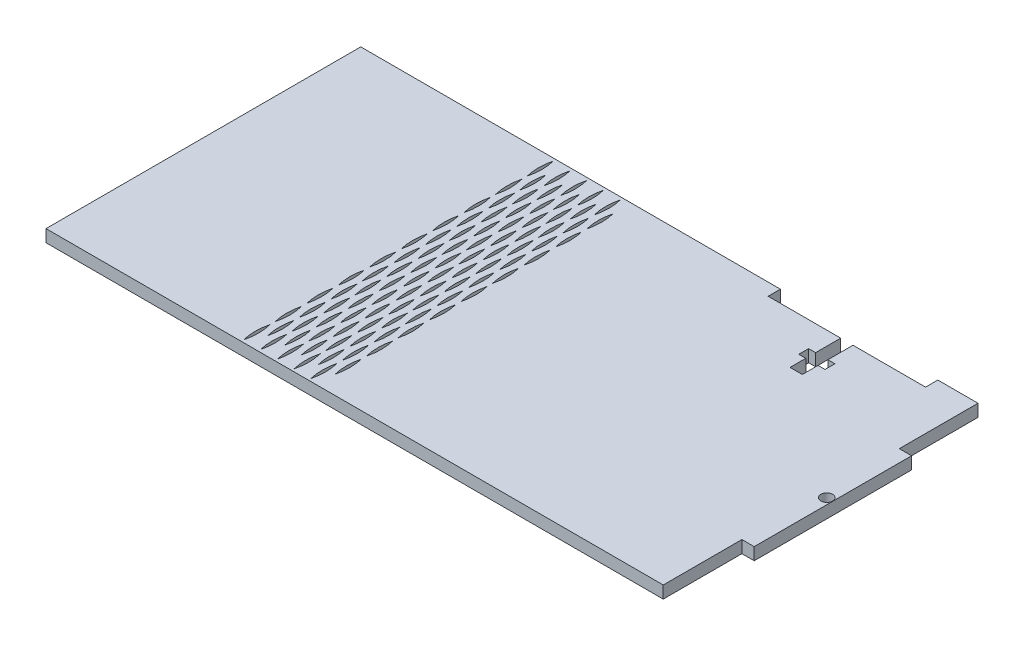
from build123d import *

# Parameters (mm, degrees)
SKETCH1_W               = 152.4
SKETCH1_H               = 76.2
BOSS_EXTRUDE1_DEPTH     = 2.9718
SKETCH2_W               = 2.9718
SKETCH2_H               = 19.05
CUT_EXTRUDE1_DEPTH      = 86.24600633
SKETCH4_R               = 1.4224
CUT_EXTRUDE3_DEPTH      = 86.24600633
CUT_EXTRUDE4_DEPTH      = 86.24600633
LPATTERN1_COUNT         = 10
LPATTERN1_PITCH         = 7.62
CUT_EXTRUDE6_DEPTH      = 86.24600633
LPATTERN2_COUNT         = 9
LPATTERN2_PITCH         = 7.62
LPATTERN3_COUNT         = 5
LPATTERN3_PITCH         = 4.064
LPATTERN3_COPY_1_DEPTH  = 86.24600633
LPATTERN3_COPY_2_DEPTH  = 86.24600633
LPATTERN3_COPY_3_DEPTH  = 86.24600633
LPATTERN3_COPY_4_DEPTH  = 86.24600633
LPATTERN3_COPY_5_DEPTH  = 86.24600633
LPATTERN3_COPY_6_DEPTH  = 86.24600633
LPATTERN3_COPY_7_DEPTH  = 86.24600633
LPATTERN3_COPY_8_DEPTH  = 86.24600633
LPATTERN3_COPY_9_DEPTH  = 86.24600633
LPATTERN3_COPY_10_DEPTH = 86.24600633
LPATTERN3_COPY_11_DEPTH = 86.24600633
LPATTERN3_COPY_12_DEPTH = 86.24600633
LPATTERN3_COPY_13_DEPTH = 86.24600633
LPATTERN3_COPY_14_DEPTH = 86.24600633
LPATTERN3_COPY_15_DEPTH = 86.24600633
LPATTERN3_COPY_16_DEPTH = 86.24600633
LPATTERN3_COPY_17_DEPTH = 86.24600633
LPATTERN3_COPY_18_DEPTH = 86.24600633
LPATTERN3_COPY_19_DEPTH = 86.24600633
LPATTERN3_COPY_20_DEPTH = 86.24600633
LPATTERN3_COPY_21_DEPTH = 86.24600633
LPATTERN3_COPY_22_DEPTH = 86.24600633
LPATTERN3_COPY_23_DEPTH = 86.24600633
LPATTERN3_COPY_24_DEPTH = 86.24600633
LPATTERN3_COPY_25_DEPTH = 86.24600633
LPATTERN3_COPY_26_DEPTH = 86.24600633
LPATTERN3_COPY_27_DEPTH = 86.24600633
LPATTERN3_COPY_28_DEPTH = 86.24600633
LPATTERN3_COPY_29_DEPTH = 86.24600633
LPATTERN3_COPY_30_DEPTH = 86.24600633
LPATTERN3_COPY_31_DEPTH = 86.24600633
LPATTERN3_COPY_32_DEPTH = 86.24600633
LPATTERN3_COPY_33_DEPTH = 86.24600633
LPATTERN3_COPY_34_DEPTH = 86.24600633
LPATTERN3_COPY_35_DEPTH = 86.24600633
LPATTERN3_COPY_36_DEPTH = 86.24600633
LPATTERN3_COPY_37_DEPTH = 86.24600633
LPATTERN3_COPY_38_DEPTH = 86.24600633
LPATTERN3_COPY_39_DEPTH = 86.24600633
LPATTERN3_COPY_40_DEPTH = 86.24600633
LPATTERN3_COPY_41_DEPTH = 86.24600633
LPATTERN3_COPY_42_DEPTH = 86.24600633
LPATTERN3_COPY_43_DEPTH = 86.24600633
LPATTERN3_COPY_44_DEPTH = 86.24600633
LPATTERN3_COPY_45_DEPTH = 86.24600633
LPATTERN3_COPY_46_DEPTH = 86.24600633
LPATTERN3_COPY_47_DEPTH = 86.24600633
LPATTERN3_COPY_48_DEPTH = 86.24600633
LPATTERN3_COPY_49_DEPTH = 86.24600633
LPATTERN3_COPY_50_DEPTH = 86.24600633
LPATTERN3_COPY_51_DEPTH = 86.24600633
LPATTERN3_COPY_52_DEPTH = 86.24600633
LPATTERN3_COPY_53_DEPTH = 86.24600633
LPATTERN3_COPY_54_DEPTH = 86.24600633
LPATTERN3_COPY_55_DEPTH = 86.24600633
LPATTERN3_COPY_56_DEPTH = 86.24600633
LPATTERN3_COPY_57_DEPTH = 86.24600633
LPATTERN3_COPY_58_DEPTH = 86.24600633
LPATTERN3_COPY_59_DEPTH = 86.24600633
LPATTERN3_COPY_60_DEPTH = 86.24600633
LPATTERN3_COPY_61_DEPTH = 86.24600633
LPATTERN3_COPY_62_DEPTH = 86.24600633
LPATTERN3_COPY_63_DEPTH = 86.24600633
LPATTERN3_COPY_64_DEPTH = 86.24600633
LPATTERN3_COPY_65_DEPTH = 86.24600633
LPATTERN3_COPY_66_DEPTH = 86.24600633
LPATTERN3_COPY_67_DEPTH = 86.24600633
LPATTERN3_COPY_68_DEPTH = 86.24600633
CUT_EXTRUDE7_DEPTH      = 86.24600633


with BuildPart() as part:
    # Sketch1 → Boss-Extrude1 (new body)
    with BuildSketch(Plane(origin=(0, 0, 0), x_dir=(1, 0, 0), z_dir=(0, 1, 0))):
        Rectangle(SKETCH1_W, SKETCH1_H)
    extrude(amount=BOSS_EXTRUDE1_DEPTH)

    # Sketch2 → Cut-Extrude1 (cut, through all)
    with BuildSketch(Plane(origin=(0, 2.9718, 0), x_dir=(1, 0, 0), z_dir=(0, 1, 0))):
        with Locations((74.7141, 28.575)):
            Rectangle(SKETCH2_W, SKETCH2_H)
    cut_extrude1 = extrude(amount=-CUT_EXTRUDE1_DEPTH, mode=Mode.SUBTRACT)

    # Mirror1: Cut-Extrude1 across plane
    add(cut_extrude1.mirror(Plane.XY), mode=Mode.SUBTRACT)

    # Sketch4 → Cut-Extrude3 (cut, through all)
    with BuildSketch(Plane(origin=(0, 2.9718, 0), x_dir=(1, 0, 0), z_dir=(0, 1, 0))):
        with Locations(Location((74.7141, 0, 0), (0, 0, 270))):
            Circle(SKETCH4_R)
    extrude(amount=-CUT_EXTRUDE3_DEPTH, mode=Mode.SUBTRACT)

    # Sketch5 → Cut-Extrude4 (cut, through all)
    with BuildSketch(Plane(origin=(0, 2.9718, 0), x_dir=(1, 0, 0), z_dir=(0, 1, 0))):
        with BuildLine():
            ThreePointArc((-12.7, 31.115), (-12.309139639, 34.29), (-12.7, 37.465))
            ThreePointArc((-12.7, 37.465), (-13.090860361, 34.29), (-12.7, 31.115))
        make_face()
    cut_extrude4 = extrude(amount=-CUT_EXTRUDE4_DEPTH, mode=Mode.SUBTRACT)

    # LPattern1: Cut-Extrude4 ×10
    with Locations(*[(0, 0, i * LPATTERN1_PITCH) for i in range(1, LPATTERN1_COUNT)]):
        add(cut_extrude4, mode=Mode.SUBTRACT)

    # Sketch5<3> → Cut-Extrude6 (cut, through all)
    with BuildSketch(Plane(origin=(0, 2.9718, 0), x_dir=(1, 0, 0), z_dir=(0, 1, 0))):
        with BuildLine():
            ThreePointArc((-12.7, 31.115), (-12.309139639, 34.29), (-12.7, 37.465))
            ThreePointArc((-12.7, 37.465), (-13.090860361, 34.29), (-12.7, 31.115))
        make_face()
        with BuildLine():
            ThreePointArc((-10.668, 27.305), (-10.277139639, 30.48), (-10.668, 33.655))
            ThreePointArc((-10.668, 33.655), (-11.058860361, 30.48), (-10.668, 27.305))
        make_face()
    cut_extrude6 = extrude(amount=-CUT_EXTRUDE6_DEPTH, mode=Mode.SUBTRACT)

    # LPattern2: Cut-Extrude6 ×9
    with Locations(*[(0, 0, i * LPATTERN2_PITCH) for i in range(1, LPATTERN2_COUNT)]):
        add(cut_extrude6, mode=Mode.SUBTRACT)

    # LPattern3: Cut-Extrude4, Cut-Extrude6 ×5
    with Locations(*[(-i * LPATTERN3_PITCH, 0, 0) for i in range(1, LPATTERN3_COUNT)]):
        add(cut_extrude4, mode=Mode.SUBTRACT)
        add(cut_extrude6, mode=Mode.SUBTRACT)

    # LPattern3 copy 1 sketch → LPattern3 copy 1 (cut, through all)
    with BuildSketch(Plane(origin=(-4.064, 2.9718, 7.62), x_dir=(1, 0, 0), z_dir=(0, 1, 0))):
        with BuildLine():
            ThreePointArc((-12.7, 31.115), (-12.309139639, 34.29), (-12.7, 37.465))
            ThreePointArc((-12.7, 37.465), (-13.090860361, 34.29), (-12.7, 31.115))
        make_face()
    extrude(amount=-LPATTERN3_COPY_1_DEPTH, mode=Mode.SUBTRACT)

    # LPattern3 copy 2 sketch → LPattern3 copy 2 (cut, through all)
    with BuildSketch(Plane(origin=(-8.128, 2.9718, 7.62), x_dir=(1, 0, 0), z_dir=(0, 1, 0))):
        with BuildLine():
            ThreePointArc((-12.7, 31.115), (-12.309139639, 34.29), (-12.7, 37.465))
            ThreePointArc((-12.7, 37.465), (-13.090860361, 34.29), (-12.7, 31.115))
        make_face()
    extrude(amount=-LPATTERN3_COPY_2_DEPTH, mode=Mode.SUBTRACT)

    # LPattern3 copy 3 sketch → LPattern3 copy 3 (cut, through all)
    with BuildSketch(Plane(origin=(-12.192, 2.9718, 7.62), x_dir=(1, 0, 0), z_dir=(0, 1, 0))):
        with BuildLine():
            ThreePointArc((-12.7, 31.115), (-12.309139639, 34.29), (-12.7, 37.465))
            ThreePointArc((-12.7, 37.465), (-13.090860361, 34.29), (-12.7, 31.115))
        make_face()
    extrude(amount=-LPATTERN3_COPY_3_DEPTH, mode=Mode.SUBTRACT)

    # LPattern3 copy 4 sketch → LPattern3 copy 4 (cut, through all)
    with BuildSketch(Plane(origin=(-16.256, 2.9718, 7.62), x_dir=(1, 0, 0), z_dir=(0, 1, 0))):
        with BuildLine():
            ThreePointArc((-12.7, 31.115), (-12.309139639, 34.29), (-12.7, 37.465))
            ThreePointArc((-12.7, 37.465), (-13.090860361, 34.29), (-12.7, 31.115))
        make_face()
    extrude(amount=-LPATTERN3_COPY_4_DEPTH, mode=Mode.SUBTRACT)

    # LPattern3 copy 5 sketch → LPattern3 copy 5 (cut, through all)
    with BuildSketch(Plane(origin=(-4.064, 2.9718, 15.24), x_dir=(1, 0, 0), z_dir=(0, 1, 0))):
        with BuildLine():
            ThreePointArc((-12.7, 31.115), (-12.309139639, 34.29), (-12.7, 37.465))
            ThreePointArc((-12.7, 37.465), (-13.090860361, 34.29), (-12.7, 31.115))
        make_face()
    extrude(amount=-LPATTERN3_COPY_5_DEPTH, mode=Mode.SUBTRACT)

    # LPattern3 copy 6 sketch → LPattern3 copy 6 (cut, through all)
    with BuildSketch(Plane(origin=(-8.128, 2.9718, 15.24), x_dir=(1, 0, 0), z_dir=(0, 1, 0))):
        with BuildLine():
            ThreePointArc((-12.7, 31.115), (-12.309139639, 34.29), (-12.7, 37.465))
            ThreePointArc((-12.7, 37.465), (-13.090860361, 34.29), (-12.7, 31.115))
        make_face()
    extrude(amount=-LPATTERN3_COPY_6_DEPTH, mode=Mode.SUBTRACT)

    # LPattern3 copy 7 sketch → LPattern3 copy 7 (cut, through all)
    with BuildSketch(Plane(origin=(-12.192, 2.9718, 15.24), x_dir=(1, 0, 0), z_dir=(0, 1, 0))):
        with BuildLine():
            ThreePointArc((-12.7, 31.115), (-12.309139639, 34.29), (-12.7, 37.465))
            ThreePointArc((-12.7, 37.465), (-13.090860361, 34.29), (-12.7, 31.115))
        make_face()
    extrude(amount=-LPATTERN3_COPY_7_DEPTH, mode=Mode.SUBTRACT)

    # LPattern3 copy 8 sketch → LPattern3 copy 8 (cut, through all)
    with BuildSketch(Plane(origin=(-16.256, 2.9718, 15.24), x_dir=(1, 0, 0), z_dir=(0, 1, 0))):
        with BuildLine():
            ThreePointArc((-12.7, 31.115), (-12.309139639, 34.29), (-12.7, 37.465))
            ThreePointArc((-12.7, 37.465), (-13.090860361, 34.29), (-12.7, 31.115))
        make_face()
    extrude(amount=-LPATTERN3_COPY_8_DEPTH, mode=Mode.SUBTRACT)

    # LPattern3 copy 9 sketch → LPattern3 copy 9 (cut, through all)
    with BuildSketch(Plane(origin=(-4.064, 2.9718, 22.86), x_dir=(1, 0, 0), z_dir=(0, 1, 0))):
        with BuildLine():
            ThreePointArc((-12.7, 31.115), (-12.309139639, 34.29), (-12.7, 37.465))
            ThreePointArc((-12.7, 37.465), (-13.090860361, 34.29), (-12.7, 31.115))
        make_face()
    extrude(amount=-LPATTERN3_COPY_9_DEPTH, mode=Mode.SUBTRACT)

    # LPattern3 copy 10 sketch → LPattern3 copy 10 (cut, through all)
    with BuildSketch(Plane(origin=(-8.128, 2.9718, 22.86), x_dir=(1, 0, 0), z_dir=(0, 1, 0))):
        with BuildLine():
            ThreePointArc((-12.7, 31.115), (-12.309139639, 34.29), (-12.7, 37.465))
            ThreePointArc((-12.7, 37.465), (-13.090860361, 34.29), (-12.7, 31.115))
        make_face()
    extrude(amount=-LPATTERN3_COPY_10_DEPTH, mode=Mode.SUBTRACT)

    # LPattern3 copy 11 sketch → LPattern3 copy 11 (cut, through all)
    with BuildSketch(Plane(origin=(-12.192, 2.9718, 22.86), x_dir=(1, 0, 0), z_dir=(0, 1, 0))):
        with BuildLine():
            ThreePointArc((-12.7, 31.115), (-12.309139639, 34.29), (-12.7, 37.465))
            ThreePointArc((-12.7, 37.465), (-13.090860361, 34.29), (-12.7, 31.115))
        make_face()
    extrude(amount=-LPATTERN3_COPY_11_DEPTH, mode=Mode.SUBTRACT)

    # LPattern3 copy 12 sketch → LPattern3 copy 12 (cut, through all)
    with BuildSketch(Plane(origin=(-16.256, 2.9718, 22.86), x_dir=(1, 0, 0), z_dir=(0, 1, 0))):
        with BuildLine():
            ThreePointArc((-12.7, 31.115), (-12.309139639, 34.29), (-12.7, 37.465))
            ThreePointArc((-12.7, 37.465), (-13.090860361, 34.29), (-12.7, 31.115))
        make_face()
    extrude(amount=-LPATTERN3_COPY_12_DEPTH, mode=Mode.SUBTRACT)

    # LPattern3 copy 13 sketch → LPattern3 copy 13 (cut, through all)
    with BuildSketch(Plane(origin=(-4.064, 2.9718, 30.48), x_dir=(1, 0, 0), z_dir=(0, 1, 0))):
        with BuildLine():
            ThreePointArc((-12.7, 31.115), (-12.309139639, 34.29), (-12.7, 37.465))
            ThreePointArc((-12.7, 37.465), (-13.090860361, 34.29), (-12.7, 31.115))
        make_face()
    extrude(amount=-LPATTERN3_COPY_13_DEPTH, mode=Mode.SUBTRACT)

    # LPattern3 copy 14 sketch → LPattern3 copy 14 (cut, through all)
    with BuildSketch(Plane(origin=(-8.128, 2.9718, 30.48), x_dir=(1, 0, 0), z_dir=(0, 1, 0))):
        with BuildLine():
            ThreePointArc((-12.7, 31.115), (-12.309139639, 34.29), (-12.7, 37.465))
            ThreePointArc((-12.7, 37.465), (-13.090860361, 34.29), (-12.7, 31.115))
        make_face()
    extrude(amount=-LPATTERN3_COPY_14_DEPTH, mode=Mode.SUBTRACT)

    # LPattern3 copy 15 sketch → LPattern3 copy 15 (cut, through all)
    with BuildSketch(Plane(origin=(-12.192, 2.9718, 30.48), x_dir=(1, 0, 0), z_dir=(0, 1, 0))):
        with BuildLine():
            ThreePointArc((-12.7, 31.115), (-12.309139639, 34.29), (-12.7, 37.465))
            ThreePointArc((-12.7, 37.465), (-13.090860361, 34.29), (-12.7, 31.115))
        make_face()
    extrude(amount=-LPATTERN3_COPY_15_DEPTH, mode=Mode.SUBTRACT)

    # LPattern3 copy 16 sketch → LPattern3 copy 16 (cut, through all)
    with BuildSketch(Plane(origin=(-16.256, 2.9718, 30.48), x_dir=(1, 0, 0), z_dir=(0, 1, 0))):
        with BuildLine():
            ThreePointArc((-12.7, 31.115), (-12.309139639, 34.29), (-12.7, 37.465))
            ThreePointArc((-12.7, 37.465), (-13.090860361, 34.29), (-12.7, 31.115))
        make_face()
    extrude(amount=-LPATTERN3_COPY_16_DEPTH, mode=Mode.SUBTRACT)

    # LPattern3 copy 17 sketch → LPattern3 copy 17 (cut, through all)
    with BuildSketch(Plane(origin=(-4.064, 2.9718, 38.1), x_dir=(1, 0, 0), z_dir=(0, 1, 0))):
        with BuildLine():
            ThreePointArc((-12.7, 31.115), (-12.309139639, 34.29), (-12.7, 37.465))
            ThreePointArc((-12.7, 37.465), (-13.090860361, 34.29), (-12.7, 31.115))
        make_face()
    extrude(amount=-LPATTERN3_COPY_17_DEPTH, mode=Mode.SUBTRACT)

    # LPattern3 copy 18 sketch → LPattern3 copy 18 (cut, through all)
    with BuildSketch(Plane(origin=(-8.128, 2.9718, 38.1), x_dir=(1, 0, 0), z_dir=(0, 1, 0))):
        with BuildLine():
            ThreePointArc((-12.7, 31.115), (-12.309139639, 34.29), (-12.7, 37.465))
            ThreePointArc((-12.7, 37.465), (-13.090860361, 34.29), (-12.7, 31.115))
        make_face()
    extrude(amount=-LPATTERN3_COPY_18_DEPTH, mode=Mode.SUBTRACT)

    # LPattern3 copy 19 sketch → LPattern3 copy 19 (cut, through all)
    with BuildSketch(Plane(origin=(-12.192, 2.9718, 38.1), x_dir=(1, 0, 0), z_dir=(0, 1, 0))):
        with BuildLine():
            ThreePointArc((-12.7, 31.115), (-12.309139639, 34.29), (-12.7, 37.465))
            ThreePointArc((-12.7, 37.465), (-13.090860361, 34.29), (-12.7, 31.115))
        make_face()
    extrude(amount=-LPATTERN3_COPY_19_DEPTH, mode=Mode.SUBTRACT)

    # LPattern3 copy 20 sketch → LPattern3 copy 20 (cut, through all)
    with BuildSketch(Plane(origin=(-16.256, 2.9718, 38.1), x_dir=(1, 0, 0), z_dir=(0, 1, 0))):
        with BuildLine():
            ThreePointArc((-12.7, 31.115), (-12.309139639, 34.29), (-12.7, 37.465))
            ThreePointArc((-12.7, 37.465), (-13.090860361, 34.29), (-12.7, 31.115))
        make_face()
    extrude(amount=-LPATTERN3_COPY_20_DEPTH, mode=Mode.SUBTRACT)

    # LPattern3 copy 21 sketch → LPattern3 copy 21 (cut, through all)
    with BuildSketch(Plane(origin=(-4.064, 2.9718, 45.72), x_dir=(1, 0, 0), z_dir=(0, 1, 0))):
        with BuildLine():
            ThreePointArc((-12.7, 31.115), (-12.309139639, 34.29), (-12.7, 37.465))
            ThreePointArc((-12.7, 37.465), (-13.090860361, 34.29), (-12.7, 31.115))
        make_face()
    extrude(amount=-LPATTERN3_COPY_21_DEPTH, mode=Mode.SUBTRACT)

    # LPattern3 copy 22 sketch → LPattern3 copy 22 (cut, through all)
    with BuildSketch(Plane(origin=(-8.128, 2.9718, 45.72), x_dir=(1, 0, 0), z_dir=(0, 1, 0))):
        with BuildLine():
            ThreePointArc((-12.7, 31.115), (-12.309139639, 34.29), (-12.7, 37.465))
            ThreePointArc((-12.7, 37.465), (-13.090860361, 34.29), (-12.7, 31.115))
        make_face()
    extrude(amount=-LPATTERN3_COPY_22_DEPTH, mode=Mode.SUBTRACT)

    # LPattern3 copy 23 sketch → LPattern3 copy 23 (cut, through all)
    with BuildSketch(Plane(origin=(-12.192, 2.9718, 45.72), x_dir=(1, 0, 0), z_dir=(0, 1, 0))):
        with BuildLine():
            ThreePointArc((-12.7, 31.115), (-12.309139639, 34.29), (-12.7, 37.465))
            ThreePointArc((-12.7, 37.465), (-13.090860361, 34.29), (-12.7, 31.115))
        make_face()
    extrude(amount=-LPATTERN3_COPY_23_DEPTH, mode=Mode.SUBTRACT)

    # LPattern3 copy 24 sketch → LPattern3 copy 24 (cut, through all)
    with BuildSketch(Plane(origin=(-16.256, 2.9718, 45.72), x_dir=(1, 0, 0), z_dir=(0, 1, 0))):
        with BuildLine():
            ThreePointArc((-12.7, 31.115), (-12.309139639, 34.29), (-12.7, 37.465))
            ThreePointArc((-12.7, 37.465), (-13.090860361, 34.29), (-12.7, 31.115))
        make_face()
    extrude(amount=-LPATTERN3_COPY_24_DEPTH, mode=Mode.SUBTRACT)

    # LPattern3 copy 25 sketch → LPattern3 copy 25 (cut, through all)
    with BuildSketch(Plane(origin=(-4.064, 2.9718, 53.34), x_dir=(1, 0, 0), z_dir=(0, 1, 0))):
        with BuildLine():
            ThreePointArc((-12.7, 31.115), (-12.309139639, 34.29), (-12.7, 37.465))
            ThreePointArc((-12.7, 37.465), (-13.090860361, 34.29), (-12.7, 31.115))
        make_face()
    extrude(amount=-LPATTERN3_COPY_25_DEPTH, mode=Mode.SUBTRACT)

    # LPattern3 copy 26 sketch → LPattern3 copy 26 (cut, through all)
    with BuildSketch(Plane(origin=(-8.128, 2.9718, 53.34), x_dir=(1, 0, 0), z_dir=(0, 1, 0))):
        with BuildLine():
            ThreePointArc((-12.7, 31.115), (-12.309139639, 34.29), (-12.7, 37.465))
            ThreePointArc((-12.7, 37.465), (-13.090860361, 34.29), (-12.7, 31.115))
        make_face()
    extrude(amount=-LPATTERN3_COPY_26_DEPTH, mode=Mode.SUBTRACT)

    # LPattern3 copy 27 sketch → LPattern3 copy 27 (cut, through all)
    with BuildSketch(Plane(origin=(-12.192, 2.9718, 53.34), x_dir=(1, 0, 0), z_dir=(0, 1, 0))):
        with BuildLine():
            ThreePointArc((-12.7, 31.115), (-12.309139639, 34.29), (-12.7, 37.465))
            ThreePointArc((-12.7, 37.465), (-13.090860361, 34.29), (-12.7, 31.115))
        make_face()
    extrude(amount=-LPATTERN3_COPY_27_DEPTH, mode=Mode.SUBTRACT)

    # LPattern3 copy 28 sketch → LPattern3 copy 28 (cut, through all)
    with BuildSketch(Plane(origin=(-16.256, 2.9718, 53.34), x_dir=(1, 0, 0), z_dir=(0, 1, 0))):
        with BuildLine():
            ThreePointArc((-12.7, 31.115), (-12.309139639, 34.29), (-12.7, 37.465))
            ThreePointArc((-12.7, 37.465), (-13.090860361, 34.29), (-12.7, 31.115))
        make_face()
    extrude(amount=-LPATTERN3_COPY_28_DEPTH, mode=Mode.SUBTRACT)

    # LPattern3 copy 29 sketch → LPattern3 copy 29 (cut, through all)
    with BuildSketch(Plane(origin=(-4.064, 2.9718, 60.96), x_dir=(1, 0, 0), z_dir=(0, 1, 0))):
        with BuildLine():
            ThreePointArc((-12.7, 31.115), (-12.309139639, 34.29), (-12.7, 37.465))
            ThreePointArc((-12.7, 37.465), (-13.090860361, 34.29), (-12.7, 31.115))
        make_face()
    extrude(amount=-LPATTERN3_COPY_29_DEPTH, mode=Mode.SUBTRACT)

    # LPattern3 copy 30 sketch → LPattern3 copy 30 (cut, through all)
    with BuildSketch(Plane(origin=(-8.128, 2.9718, 60.96), x_dir=(1, 0, 0), z_dir=(0, 1, 0))):
        with BuildLine():
            ThreePointArc((-12.7, 31.115), (-12.309139639, 34.29), (-12.7, 37.465))
            ThreePointArc((-12.7, 37.465), (-13.090860361, 34.29), (-12.7, 31.115))
        make_face()
    extrude(amount=-LPATTERN3_COPY_30_DEPTH, mode=Mode.SUBTRACT)

    # LPattern3 copy 31 sketch → LPattern3 copy 31 (cut, through all)
    with BuildSketch(Plane(origin=(-12.192, 2.9718, 60.96), x_dir=(1, 0, 0), z_dir=(0, 1, 0))):
        with BuildLine():
            ThreePointArc((-12.7, 31.115), (-12.309139639, 34.29), (-12.7, 37.465))
            ThreePointArc((-12.7, 37.465), (-13.090860361, 34.29), (-12.7, 31.115))
        make_face()
    extrude(amount=-LPATTERN3_COPY_31_DEPTH, mode=Mode.SUBTRACT)

    # LPattern3 copy 32 sketch → LPattern3 copy 32 (cut, through all)
    with BuildSketch(Plane(origin=(-16.256, 2.9718, 60.96), x_dir=(1, 0, 0), z_dir=(0, 1, 0))):
        with BuildLine():
            ThreePointArc((-12.7, 31.115), (-12.309139639, 34.29), (-12.7, 37.465))
            ThreePointArc((-12.7, 37.465), (-13.090860361, 34.29), (-12.7, 31.115))
        make_face()
    extrude(amount=-LPATTERN3_COPY_32_DEPTH, mode=Mode.SUBTRACT)

    # LPattern3 copy 33 sketch → LPattern3 copy 33 (cut, through all)
    with BuildSketch(Plane(origin=(-4.064, 2.9718, 68.58), x_dir=(1, 0, 0), z_dir=(0, 1, 0))):
        with BuildLine():
            ThreePointArc((-12.7, 31.115), (-12.309139639, 34.29), (-12.7, 37.465))
            ThreePointArc((-12.7, 37.465), (-13.090860361, 34.29), (-12.7, 31.115))
        make_face()
    extrude(amount=-LPATTERN3_COPY_33_DEPTH, mode=Mode.SUBTRACT)

    # LPattern3 copy 34 sketch → LPattern3 copy 34 (cut, through all)
    with BuildSketch(Plane(origin=(-8.128, 2.9718, 68.58), x_dir=(1, 0, 0), z_dir=(0, 1, 0))):
        with BuildLine():
            ThreePointArc((-12.7, 31.115), (-12.309139639, 34.29), (-12.7, 37.465))
            ThreePointArc((-12.7, 37.465), (-13.090860361, 34.29), (-12.7, 31.115))
        make_face()
    extrude(amount=-LPATTERN3_COPY_34_DEPTH, mode=Mode.SUBTRACT)

    # LPattern3 copy 35 sketch → LPattern3 copy 35 (cut, through all)
    with BuildSketch(Plane(origin=(-12.192, 2.9718, 68.58), x_dir=(1, 0, 0), z_dir=(0, 1, 0))):
        with BuildLine():
            ThreePointArc((-12.7, 31.115), (-12.309139639, 34.29), (-12.7, 37.465))
            ThreePointArc((-12.7, 37.465), (-13.090860361, 34.29), (-12.7, 31.115))
        make_face()
    extrude(amount=-LPATTERN3_COPY_35_DEPTH, mode=Mode.SUBTRACT)

    # LPattern3 copy 36 sketch → LPattern3 copy 36 (cut, through all)
    with BuildSketch(Plane(origin=(-16.256, 2.9718, 68.58), x_dir=(1, 0, 0), z_dir=(0, 1, 0))):
        with BuildLine():
            ThreePointArc((-12.7, 31.115), (-12.309139639, 34.29), (-12.7, 37.465))
            ThreePointArc((-12.7, 37.465), (-13.090860361, 34.29), (-12.7, 31.115))
        make_face()
    extrude(amount=-LPATTERN3_COPY_36_DEPTH, mode=Mode.SUBTRACT)

    # LPattern3 copy 37 sketch → LPattern3 copy 37 (cut, through all)
    with BuildSketch(Plane(origin=(-4.064, 2.9718, 7.62), x_dir=(1, 0, 0), z_dir=(0, 1, 0))):
        with BuildLine():
            ThreePointArc((-12.7, 31.115), (-12.309139639, 34.29), (-12.7, 37.465))
            ThreePointArc((-12.7, 37.465), (-13.090860361, 34.29), (-12.7, 31.115))
        make_face()
        with BuildLine():
            ThreePointArc((-10.668, 27.305), (-10.277139639, 30.48), (-10.668, 33.655))
            ThreePointArc((-10.668, 33.655), (-11.058860361, 30.48), (-10.668, 27.305))
        make_face()
    extrude(amount=-LPATTERN3_COPY_37_DEPTH, mode=Mode.SUBTRACT)

    # LPattern3 copy 38 sketch → LPattern3 copy 38 (cut, through all)
    with BuildSketch(Plane(origin=(-8.128, 2.9718, 7.62), x_dir=(1, 0, 0), z_dir=(0, 1, 0))):
        with BuildLine():
            ThreePointArc((-12.7, 31.115), (-12.309139639, 34.29), (-12.7, 37.465))
            ThreePointArc((-12.7, 37.465), (-13.090860361, 34.29), (-12.7, 31.115))
        make_face()
        with BuildLine():
            ThreePointArc((-10.668, 27.305), (-10.277139639, 30.48), (-10.668, 33.655))
            ThreePointArc((-10.668, 33.655), (-11.058860361, 30.48), (-10.668, 27.305))
        make_face()
    extrude(amount=-LPATTERN3_COPY_38_DEPTH, mode=Mode.SUBTRACT)

    # LPattern3 copy 39 sketch → LPattern3 copy 39 (cut, through all)
    with BuildSketch(Plane(origin=(-12.192, 2.9718, 7.62), x_dir=(1, 0, 0), z_dir=(0, 1, 0))):
        with BuildLine():
            ThreePointArc((-12.7, 31.115), (-12.309139639, 34.29), (-12.7, 37.465))
            ThreePointArc((-12.7, 37.465), (-13.090860361, 34.29), (-12.7, 31.115))
        make_face()
        with BuildLine():
            ThreePointArc((-10.668, 27.305), (-10.277139639, 30.48), (-10.668, 33.655))
            ThreePointArc((-10.668, 33.655), (-11.058860361, 30.48), (-10.668, 27.305))
        make_face()
    extrude(amount=-LPATTERN3_COPY_39_DEPTH, mode=Mode.SUBTRACT)

    # LPattern3 copy 40 sketch → LPattern3 copy 40 (cut, through all)
    with BuildSketch(Plane(origin=(-16.256, 2.9718, 7.62), x_dir=(1, 0, 0), z_dir=(0, 1, 0))):
        with BuildLine():
            ThreePointArc((-12.7, 31.115), (-12.309139639, 34.29), (-12.7, 37.465))
            ThreePointArc((-12.7, 37.465), (-13.090860361, 34.29), (-12.7, 31.115))
        make_face()
        with BuildLine():
            ThreePointArc((-10.668, 27.305), (-10.277139639, 30.48), (-10.668, 33.655))
            ThreePointArc((-10.668, 33.655), (-11.058860361, 30.48), (-10.668, 27.305))
        make_face()
    extrude(amount=-LPATTERN3_COPY_40_DEPTH, mode=Mode.SUBTRACT)

    # LPattern3 copy 41 sketch → LPattern3 copy 41 (cut, through all)
    with BuildSketch(Plane(origin=(-4.064, 2.9718, 15.24), x_dir=(1, 0, 0), z_dir=(0, 1, 0))):
        with BuildLine():
            ThreePointArc((-12.7, 31.115), (-12.309139639, 34.29), (-12.7, 37.465))
            ThreePointArc((-12.7, 37.465), (-13.090860361, 34.29), (-12.7, 31.115))
        make_face()
        with BuildLine():
            ThreePointArc((-10.668, 27.305), (-10.277139639, 30.48), (-10.668, 33.655))
            ThreePointArc((-10.668, 33.655), (-11.058860361, 30.48), (-10.668, 27.305))
        make_face()
    extrude(amount=-LPATTERN3_COPY_41_DEPTH, mode=Mode.SUBTRACT)

    # LPattern3 copy 42 sketch → LPattern3 copy 42 (cut, through all)
    with BuildSketch(Plane(origin=(-8.128, 2.9718, 15.24), x_dir=(1, 0, 0), z_dir=(0, 1, 0))):
        with BuildLine():
            ThreePointArc((-12.7, 31.115), (-12.309139639, 34.29), (-12.7, 37.465))
            ThreePointArc((-12.7, 37.465), (-13.090860361, 34.29), (-12.7, 31.115))
        make_face()
        with BuildLine():
            ThreePointArc((-10.668, 27.305), (-10.277139639, 30.48), (-10.668, 33.655))
            ThreePointArc((-10.668, 33.655), (-11.058860361, 30.48), (-10.668, 27.305))
        make_face()
    extrude(amount=-LPATTERN3_COPY_42_DEPTH, mode=Mode.SUBTRACT)

    # LPattern3 copy 43 sketch → LPattern3 copy 43 (cut, through all)
    with BuildSketch(Plane(origin=(-12.192, 2.9718, 15.24), x_dir=(1, 0, 0), z_dir=(0, 1, 0))):
        with BuildLine():
            ThreePointArc((-12.7, 31.115), (-12.309139639, 34.29), (-12.7, 37.465))
            ThreePointArc((-12.7, 37.465), (-13.090860361, 34.29), (-12.7, 31.115))
        make_face()
        with BuildLine():
            ThreePointArc((-10.668, 27.305), (-10.277139639, 30.48), (-10.668, 33.655))
            ThreePointArc((-10.668, 33.655), (-11.058860361, 30.48), (-10.668, 27.305))
        make_face()
    extrude(amount=-LPATTERN3_COPY_43_DEPTH, mode=Mode.SUBTRACT)

    # LPattern3 copy 44 sketch → LPattern3 copy 44 (cut, through all)
    with BuildSketch(Plane(origin=(-16.256, 2.9718, 15.24), x_dir=(1, 0, 0), z_dir=(0, 1, 0))):
        with BuildLine():
            ThreePointArc((-12.7, 31.115), (-12.309139639, 34.29), (-12.7, 37.465))
            ThreePointArc((-12.7, 37.465), (-13.090860361, 34.29), (-12.7, 31.115))
        make_face()
        with BuildLine():
            ThreePointArc((-10.668, 27.305), (-10.277139639, 30.48), (-10.668, 33.655))
            ThreePointArc((-10.668, 33.655), (-11.058860361, 30.48), (-10.668, 27.305))
        make_face()
    extrude(amount=-LPATTERN3_COPY_44_DEPTH, mode=Mode.SUBTRACT)

    # LPattern3 copy 45 sketch → LPattern3 copy 45 (cut, through all)
    with BuildSketch(Plane(origin=(-4.064, 2.9718, 22.86), x_dir=(1, 0, 0), z_dir=(0, 1, 0))):
        with BuildLine():
            ThreePointArc((-12.7, 31.115), (-12.309139639, 34.29), (-12.7, 37.465))
            ThreePointArc((-12.7, 37.465), (-13.090860361, 34.29), (-12.7, 31.115))
        make_face()
        with BuildLine():
            ThreePointArc((-10.668, 27.305), (-10.277139639, 30.48), (-10.668, 33.655))
            ThreePointArc((-10.668, 33.655), (-11.058860361, 30.48), (-10.668, 27.305))
        make_face()
    extrude(amount=-LPATTERN3_COPY_45_DEPTH, mode=Mode.SUBTRACT)

    # LPattern3 copy 46 sketch → LPattern3 copy 46 (cut, through all)
    with BuildSketch(Plane(origin=(-8.128, 2.9718, 22.86), x_dir=(1, 0, 0), z_dir=(0, 1, 0))):
        with BuildLine():
            ThreePointArc((-12.7, 31.115), (-12.309139639, 34.29), (-12.7, 37.465))
            ThreePointArc((-12.7, 37.465), (-13.090860361, 34.29), (-12.7, 31.115))
        make_face()
        with BuildLine():
            ThreePointArc((-10.668, 27.305), (-10.277139639, 30.48), (-10.668, 33.655))
            ThreePointArc((-10.668, 33.655), (-11.058860361, 30.48), (-10.668, 27.305))
        make_face()
    extrude(amount=-LPATTERN3_COPY_46_DEPTH, mode=Mode.SUBTRACT)

    # LPattern3 copy 47 sketch → LPattern3 copy 47 (cut, through all)
    with BuildSketch(Plane(origin=(-12.192, 2.9718, 22.86), x_dir=(1, 0, 0), z_dir=(0, 1, 0))):
        with BuildLine():
            ThreePointArc((-12.7, 31.115), (-12.309139639, 34.29), (-12.7, 37.465))
            ThreePointArc((-12.7, 37.465), (-13.090860361, 34.29), (-12.7, 31.115))
        make_face()
        with BuildLine():
            ThreePointArc((-10.668, 27.305), (-10.277139639, 30.48), (-10.668, 33.655))
            ThreePointArc((-10.668, 33.655), (-11.058860361, 30.48), (-10.668, 27.305))
        make_face()
    extrude(amount=-LPATTERN3_COPY_47_DEPTH, mode=Mode.SUBTRACT)

    # LPattern3 copy 48 sketch → LPattern3 copy 48 (cut, through all)
    with BuildSketch(Plane(origin=(-16.256, 2.9718, 22.86), x_dir=(1, 0, 0), z_dir=(0, 1, 0))):
        with BuildLine():
            ThreePointArc((-12.7, 31.115), (-12.309139639, 34.29), (-12.7, 37.465))
            ThreePointArc((-12.7, 37.465), (-13.090860361, 34.29), (-12.7, 31.115))
        make_face()
        with BuildLine():
            ThreePointArc((-10.668, 27.305), (-10.277139639, 30.48), (-10.668, 33.655))
            ThreePointArc((-10.668, 33.655), (-11.058860361, 30.48), (-10.668, 27.305))
        make_face()
    extrude(amount=-LPATTERN3_COPY_48_DEPTH, mode=Mode.SUBTRACT)

    # LPattern3 copy 49 sketch → LPattern3 copy 49 (cut, through all)
    with BuildSketch(Plane(origin=(-4.064, 2.9718, 30.48), x_dir=(1, 0, 0), z_dir=(0, 1, 0))):
        with BuildLine():
            ThreePointArc((-12.7, 31.115), (-12.309139639, 34.29), (-12.7, 37.465))
            ThreePointArc((-12.7, 37.465), (-13.090860361, 34.29), (-12.7, 31.115))
        make_face()
        with BuildLine():
            ThreePointArc((-10.668, 27.305), (-10.277139639, 30.48), (-10.668, 33.655))
            ThreePointArc((-10.668, 33.655), (-11.058860361, 30.48), (-10.668, 27.305))
        make_face()
    extrude(amount=-LPATTERN3_COPY_49_DEPTH, mode=Mode.SUBTRACT)

    # LPattern3 copy 50 sketch → LPattern3 copy 50 (cut, through all)
    with BuildSketch(Plane(origin=(-8.128, 2.9718, 30.48), x_dir=(1, 0, 0), z_dir=(0, 1, 0))):
        with BuildLine():
            ThreePointArc((-12.7, 31.115), (-12.309139639, 34.29), (-12.7, 37.465))
            ThreePointArc((-12.7, 37.465), (-13.090860361, 34.29), (-12.7, 31.115))
        make_face()
        with BuildLine():
            ThreePointArc((-10.668, 27.305), (-10.277139639, 30.48), (-10.668, 33.655))
            ThreePointArc((-10.668, 33.655), (-11.058860361, 30.48), (-10.668, 27.305))
        make_face()
    extrude(amount=-LPATTERN3_COPY_50_DEPTH, mode=Mode.SUBTRACT)

    # LPattern3 copy 51 sketch → LPattern3 copy 51 (cut, through all)
    with BuildSketch(Plane(origin=(-12.192, 2.9718, 30.48), x_dir=(1, 0, 0), z_dir=(0, 1, 0))):
        with BuildLine():
            ThreePointArc((-12.7, 31.115), (-12.309139639, 34.29), (-12.7, 37.465))
            ThreePointArc((-12.7, 37.465), (-13.090860361, 34.29), (-12.7, 31.115))
        make_face()
        with BuildLine():
            ThreePointArc((-10.668, 27.305), (-10.277139639, 30.48), (-10.668, 33.655))
            ThreePointArc((-10.668, 33.655), (-11.058860361, 30.48), (-10.668, 27.305))
        make_face()
    extrude(amount=-LPATTERN3_COPY_51_DEPTH, mode=Mode.SUBTRACT)

    # LPattern3 copy 52 sketch → LPattern3 copy 52 (cut, through all)
    with BuildSketch(Plane(origin=(-16.256, 2.9718, 30.48), x_dir=(1, 0, 0), z_dir=(0, 1, 0))):
        with BuildLine():
            ThreePointArc((-12.7, 31.115), (-12.309139639, 34.29), (-12.7, 37.465))
            ThreePointArc((-12.7, 37.465), (-13.090860361, 34.29), (-12.7, 31.115))
        make_face()
        with BuildLine():
            ThreePointArc((-10.668, 27.305), (-10.277139639, 30.48), (-10.668, 33.655))
            ThreePointArc((-10.668, 33.655), (-11.058860361, 30.48), (-10.668, 27.305))
        make_face()
    extrude(amount=-LPATTERN3_COPY_52_DEPTH, mode=Mode.SUBTRACT)

    # LPattern3 copy 53 sketch → LPattern3 copy 53 (cut, through all)
    with BuildSketch(Plane(origin=(-4.064, 2.9718, 38.1), x_dir=(1, 0, 0), z_dir=(0, 1, 0))):
        with BuildLine():
            ThreePointArc((-12.7, 31.115), (-12.309139639, 34.29), (-12.7, 37.465))
            ThreePointArc((-12.7, 37.465), (-13.090860361, 34.29), (-12.7, 31.115))
        make_face()
        with BuildLine():
            ThreePointArc((-10.668, 27.305), (-10.277139639, 30.48), (-10.668, 33.655))
            ThreePointArc((-10.668, 33.655), (-11.058860361, 30.48), (-10.668, 27.305))
        make_face()
    extrude(amount=-LPATTERN3_COPY_53_DEPTH, mode=Mode.SUBTRACT)

    # LPattern3 copy 54 sketch → LPattern3 copy 54 (cut, through all)
    with BuildSketch(Plane(origin=(-8.128, 2.9718, 38.1), x_dir=(1, 0, 0), z_dir=(0, 1, 0))):
        with BuildLine():
            ThreePointArc((-12.7, 31.115), (-12.309139639, 34.29), (-12.7, 37.465))
            ThreePointArc((-12.7, 37.465), (-13.090860361, 34.29), (-12.7, 31.115))
        make_face()
        with BuildLine():
            ThreePointArc((-10.668, 27.305), (-10.277139639, 30.48), (-10.668, 33.655))
            ThreePointArc((-10.668, 33.655), (-11.058860361, 30.48), (-10.668, 27.305))
        make_face()
    extrude(amount=-LPATTERN3_COPY_54_DEPTH, mode=Mode.SUBTRACT)

    # LPattern3 copy 55 sketch → LPattern3 copy 55 (cut, through all)
    with BuildSketch(Plane(origin=(-12.192, 2.9718, 38.1), x_dir=(1, 0, 0), z_dir=(0, 1, 0))):
        with BuildLine():
            ThreePointArc((-12.7, 31.115), (-12.309139639, 34.29), (-12.7, 37.465))
            ThreePointArc((-12.7, 37.465), (-13.090860361, 34.29), (-12.7, 31.115))
        make_face()
        with BuildLine():
            ThreePointArc((-10.668, 27.305), (-10.277139639, 30.48), (-10.668, 33.655))
            ThreePointArc((-10.668, 33.655), (-11.058860361, 30.48), (-10.668, 27.305))
        make_face()
    extrude(amount=-LPATTERN3_COPY_55_DEPTH, mode=Mode.SUBTRACT)

    # LPattern3 copy 56 sketch → LPattern3 copy 56 (cut, through all)
    with BuildSketch(Plane(origin=(-16.256, 2.9718, 38.1), x_dir=(1, 0, 0), z_dir=(0, 1, 0))):
        with BuildLine():
            ThreePointArc((-12.7, 31.115), (-12.309139639, 34.29), (-12.7, 37.465))
            ThreePointArc((-12.7, 37.465), (-13.090860361, 34.29), (-12.7, 31.115))
        make_face()
        with BuildLine():
            ThreePointArc((-10.668, 27.305), (-10.277139639, 30.48), (-10.668, 33.655))
            ThreePointArc((-10.668, 33.655), (-11.058860361, 30.48), (-10.668, 27.305))
        make_face()
    extrude(amount=-LPATTERN3_COPY_56_DEPTH, mode=Mode.SUBTRACT)

    # LPattern3 copy 57 sketch → LPattern3 copy 57 (cut, through all)
    with BuildSketch(Plane(origin=(-4.064, 2.9718, 45.72), x_dir=(1, 0, 0), z_dir=(0, 1, 0))):
        with BuildLine():
            ThreePointArc((-12.7, 31.115), (-12.309139639, 34.29), (-12.7, 37.465))
            ThreePointArc((-12.7, 37.465), (-13.090860361, 34.29), (-12.7, 31.115))
        make_face()
        with BuildLine():
            ThreePointArc((-10.668, 27.305), (-10.277139639, 30.48), (-10.668, 33.655))
            ThreePointArc((-10.668, 33.655), (-11.058860361, 30.48), (-10.668, 27.305))
        make_face()
    extrude(amount=-LPATTERN3_COPY_57_DEPTH, mode=Mode.SUBTRACT)

    # LPattern3 copy 58 sketch → LPattern3 copy 58 (cut, through all)
    with BuildSketch(Plane(origin=(-8.128, 2.9718, 45.72), x_dir=(1, 0, 0), z_dir=(0, 1, 0))):
        with BuildLine():
            ThreePointArc((-12.7, 31.115), (-12.309139639, 34.29), (-12.7, 37.465))
            ThreePointArc((-12.7, 37.465), (-13.090860361, 34.29), (-12.7, 31.115))
        make_face()
        with BuildLine():
            ThreePointArc((-10.668, 27.305), (-10.277139639, 30.48), (-10.668, 33.655))
            ThreePointArc((-10.668, 33.655), (-11.058860361, 30.48), (-10.668, 27.305))
        make_face()
    extrude(amount=-LPATTERN3_COPY_58_DEPTH, mode=Mode.SUBTRACT)

    # LPattern3 copy 59 sketch → LPattern3 copy 59 (cut, through all)
    with BuildSketch(Plane(origin=(-12.192, 2.9718, 45.72), x_dir=(1, 0, 0), z_dir=(0, 1, 0))):
        with BuildLine():
            ThreePointArc((-12.7, 31.115), (-12.309139639, 34.29), (-12.7, 37.465))
            ThreePointArc((-12.7, 37.465), (-13.090860361, 34.29), (-12.7, 31.115))
        make_face()
        with BuildLine():
            ThreePointArc((-10.668, 27.305), (-10.277139639, 30.48), (-10.668, 33.655))
            ThreePointArc((-10.668, 33.655), (-11.058860361, 30.48), (-10.668, 27.305))
        make_face()
    extrude(amount=-LPATTERN3_COPY_59_DEPTH, mode=Mode.SUBTRACT)

    # LPattern3 copy 60 sketch → LPattern3 copy 60 (cut, through all)
    with BuildSketch(Plane(origin=(-16.256, 2.9718, 45.72), x_dir=(1, 0, 0), z_dir=(0, 1, 0))):
        with BuildLine():
            ThreePointArc((-12.7, 31.115), (-12.309139639, 34.29), (-12.7, 37.465))
            ThreePointArc((-12.7, 37.465), (-13.090860361, 34.29), (-12.7, 31.115))
        make_face()
        with BuildLine():
            ThreePointArc((-10.668, 27.305), (-10.277139639, 30.48), (-10.668, 33.655))
            ThreePointArc((-10.668, 33.655), (-11.058860361, 30.48), (-10.668, 27.305))
        make_face()
    extrude(amount=-LPATTERN3_COPY_60_DEPTH, mode=Mode.SUBTRACT)

    # LPattern3 copy 61 sketch → LPattern3 copy 61 (cut, through all)
    with BuildSketch(Plane(origin=(-4.064, 2.9718, 53.34), x_dir=(1, 0, 0), z_dir=(0, 1, 0))):
        with BuildLine():
            ThreePointArc((-12.7, 31.115), (-12.309139639, 34.29), (-12.7, 37.465))
            ThreePointArc((-12.7, 37.465), (-13.090860361, 34.29), (-12.7, 31.115))
        make_face()
        with BuildLine():
            ThreePointArc((-10.668, 27.305), (-10.277139639, 30.48), (-10.668, 33.655))
            ThreePointArc((-10.668, 33.655), (-11.058860361, 30.48), (-10.668, 27.305))
        make_face()
    extrude(amount=-LPATTERN3_COPY_61_DEPTH, mode=Mode.SUBTRACT)

    # LPattern3 copy 62 sketch → LPattern3 copy 62 (cut, through all)
    with BuildSketch(Plane(origin=(-8.128, 2.9718, 53.34), x_dir=(1, 0, 0), z_dir=(0, 1, 0))):
        with BuildLine():
            ThreePointArc((-12.7, 31.115), (-12.309139639, 34.29), (-12.7, 37.465))
            ThreePointArc((-12.7, 37.465), (-13.090860361, 34.29), (-12.7, 31.115))
        make_face()
        with BuildLine():
            ThreePointArc((-10.668, 27.305), (-10.277139639, 30.48), (-10.668, 33.655))
            ThreePointArc((-10.668, 33.655), (-11.058860361, 30.48), (-10.668, 27.305))
        make_face()
    extrude(amount=-LPATTERN3_COPY_62_DEPTH, mode=Mode.SUBTRACT)

    # LPattern3 copy 63 sketch → LPattern3 copy 63 (cut, through all)
    with BuildSketch(Plane(origin=(-12.192, 2.9718, 53.34), x_dir=(1, 0, 0), z_dir=(0, 1, 0))):
        with BuildLine():
            ThreePointArc((-12.7, 31.115), (-12.309139639, 34.29), (-12.7, 37.465))
            ThreePointArc((-12.7, 37.465), (-13.090860361, 34.29), (-12.7, 31.115))
        make_face()
        with BuildLine():
            ThreePointArc((-10.668, 27.305), (-10.277139639, 30.48), (-10.668, 33.655))
            ThreePointArc((-10.668, 33.655), (-11.058860361, 30.48), (-10.668, 27.305))
        make_face()
    extrude(amount=-LPATTERN3_COPY_63_DEPTH, mode=Mode.SUBTRACT)

    # LPattern3 copy 64 sketch → LPattern3 copy 64 (cut, through all)
    with BuildSketch(Plane(origin=(-16.256, 2.9718, 53.34), x_dir=(1, 0, 0), z_dir=(0, 1, 0))):
        with BuildLine():
            ThreePointArc((-12.7, 31.115), (-12.309139639, 34.29), (-12.7, 37.465))
            ThreePointArc((-12.7, 37.465), (-13.090860361, 34.29), (-12.7, 31.115))
        make_face()
        with BuildLine():
            ThreePointArc((-10.668, 27.305), (-10.277139639, 30.48), (-10.668, 33.655))
            ThreePointArc((-10.668, 33.655), (-11.058860361, 30.48), (-10.668, 27.305))
        make_face()
    extrude(amount=-LPATTERN3_COPY_64_DEPTH, mode=Mode.SUBTRACT)

    # LPattern3 copy 65 sketch → LPattern3 copy 65 (cut, through all)
    with BuildSketch(Plane(origin=(-4.064, 2.9718, 60.96), x_dir=(1, 0, 0), z_dir=(0, 1, 0))):
        with BuildLine():
            ThreePointArc((-12.7, 31.115), (-12.309139639, 34.29), (-12.7, 37.465))
            ThreePointArc((-12.7, 37.465), (-13.090860361, 34.29), (-12.7, 31.115))
        make_face()
        with BuildLine():
            ThreePointArc((-10.668, 27.305), (-10.277139639, 30.48), (-10.668, 33.655))
            ThreePointArc((-10.668, 33.655), (-11.058860361, 30.48), (-10.668, 27.305))
        make_face()
    extrude(amount=-LPATTERN3_COPY_65_DEPTH, mode=Mode.SUBTRACT)

    # LPattern3 copy 66 sketch → LPattern3 copy 66 (cut, through all)
    with BuildSketch(Plane(origin=(-8.128, 2.9718, 60.96), x_dir=(1, 0, 0), z_dir=(0, 1, 0))):
        with BuildLine():
            ThreePointArc((-12.7, 31.115), (-12.309139639, 34.29), (-12.7, 37.465))
            ThreePointArc((-12.7, 37.465), (-13.090860361, 34.29), (-12.7, 31.115))
        make_face()
        with BuildLine():
            ThreePointArc((-10.668, 27.305), (-10.277139639, 30.48), (-10.668, 33.655))
            ThreePointArc((-10.668, 33.655), (-11.058860361, 30.48), (-10.668, 27.305))
        make_face()
    extrude(amount=-LPATTERN3_COPY_66_DEPTH, mode=Mode.SUBTRACT)

    # LPattern3 copy 67 sketch → LPattern3 copy 67 (cut, through all)
    with BuildSketch(Plane(origin=(-12.192, 2.9718, 60.96), x_dir=(1, 0, 0), z_dir=(0, 1, 0))):
        with BuildLine():
            ThreePointArc((-12.7, 31.115), (-12.309139639, 34.29), (-12.7, 37.465))
            ThreePointArc((-12.7, 37.465), (-13.090860361, 34.29), (-12.7, 31.115))
        make_face()
        with BuildLine():
            ThreePointArc((-10.668, 27.305), (-10.277139639, 30.48), (-10.668, 33.655))
            ThreePointArc((-10.668, 33.655), (-11.058860361, 30.48), (-10.668, 27.305))
        make_face()
    extrude(amount=-LPATTERN3_COPY_67_DEPTH, mode=Mode.SUBTRACT)

    # LPattern3 copy 68 sketch → LPattern3 copy 68 (cut, through all)
    with BuildSketch(Plane(origin=(-16.256, 2.9718, 60.96), x_dir=(1, 0, 0), z_dir=(0, 1, 0))):
        with BuildLine():
            ThreePointArc((-12.7, 31.115), (-12.309139639, 34.29), (-12.7, 37.465))
            ThreePointArc((-12.7, 37.465), (-13.090860361, 34.29), (-12.7, 31.115))
        make_face()
        with BuildLine():
            ThreePointArc((-10.668, 27.305), (-10.277139639, 30.48), (-10.668, 33.655))
            ThreePointArc((-10.668, 33.655), (-11.058860361, 30.48), (-10.668, 27.305))
        make_face()
    extrude(amount=-LPATTERN3_COPY_68_DEPTH, mode=Mode.SUBTRACT)

    # Sketch6 → Cut-Extrude7 (cut, through all)
    with BuildSketch(Plane(origin=(0, 2.9718, 0), x_dir=(1, 0, 0), z_dir=(0, 1, 0))):
        Polygon((63.5, 38.1), (25.4, 38.1), (25.4, 35.1282), (42.9641, 35.1282), (42.9641, 29.05125), (41.275, 29.05125), (41.275, 26.67), (42.9641, 26.67), (42.9641, 22.86), (45.9359, 22.86), (45.9359, 26.67), (47.625, 26.67), (47.625, 29.05125), (45.9359, 29.05125), (45.9359, 35.1282), (63.5, 35.1282), align=None)
    extrude(amount=-CUT_EXTRUDE7_DEPTH, mode=Mode.SUBTRACT)


solid = part.part
